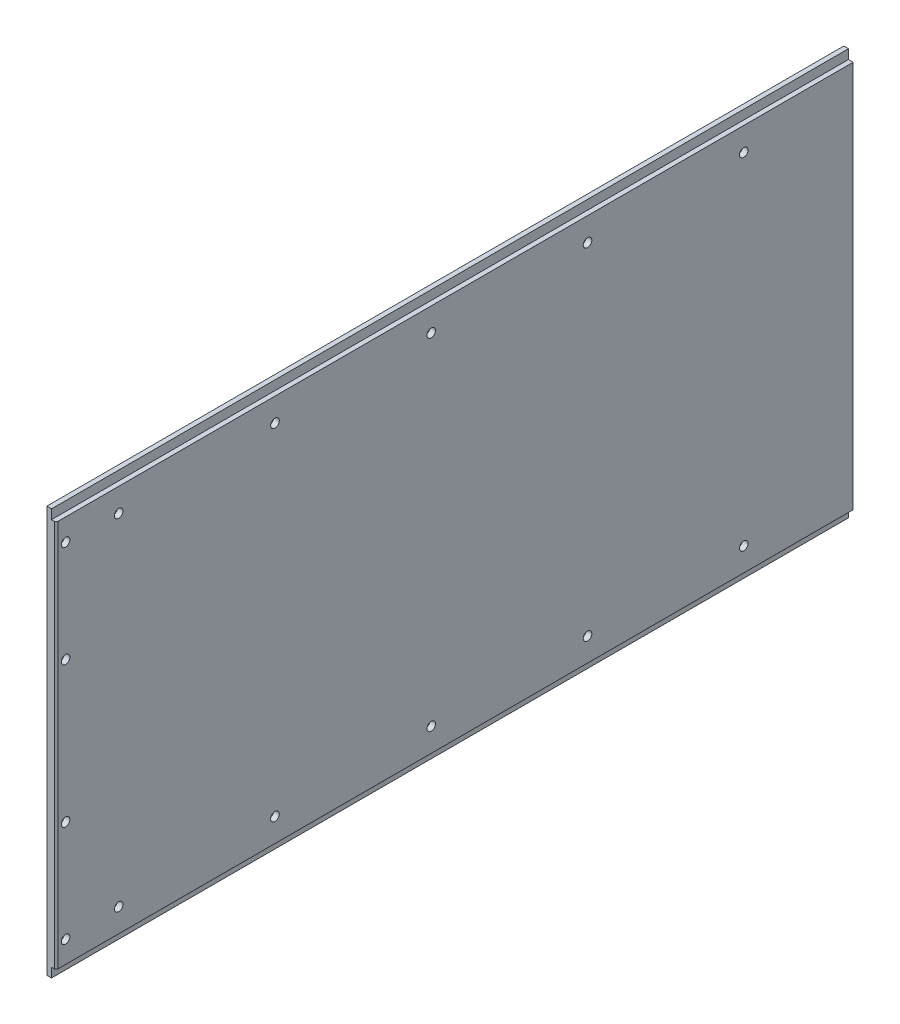
from build123d import *

# Parameters (mm, degrees)
SKETCH1_W                                            = 510
SKETCH1_H                                            = 260
BOSS_EXTRUDE1_DEPTH                                  = 6
SKIZZE2_W                                            = 3
SKIZZE2_H                                            = 6
SCHNITT_LINEAR_AUSTRAGEN1_DEPTH                      = 527.34209408
FORMSENKUNG_FUR_M5_LINSENSENKSCHRAUBE_MI_D           = 5.5
FORMSENKUNG_FUR_M5_LINSENSENKSCHRAUBE_MI_CSINK_D     = 10.4
FORMSENKUNG_FUR_M5_LINSENSENKSCHRAUBE_MI_CSINK_ANGLE = 90
CHAMFER1_SIZE                                        = 1
CSK_FOR_M5_COUNTERSUNK_RAISED_HEAD_SCREW_D           = 5.5
CSK_FOR_M5_COUNTERSUNK_RAISED_HEAD_SCREW_CSINK_D     = 10.4
CSK_FOR_M5_COUNTERSUNK_RAISED_HEAD_SCREW_CSINK_ANGLE = 90
LPATTERN1_COUNT                                      = 5
LPATTERN1_PITCH                                      = 100
SPIEGELN1_COPY_1_D                                   = 5.5
SPIEGELN1_COPY_1_CSINK_D                             = 10.4
SPIEGELN1_COPY_1_CSINK_ANGLE                         = 90
SPIEGELN1_COPY_2_D                                   = 5.5
SPIEGELN1_COPY_2_CSINK_D                             = 10.4
SPIEGELN1_COPY_2_CSINK_ANGLE                         = 90
SPIEGELN1_COPY_3_D                                   = 5.5
SPIEGELN1_COPY_3_CSINK_D                             = 10.4
SPIEGELN1_COPY_3_CSINK_ANGLE                         = 90
SPIEGELN1_COPY_4_D                                   = 5.5
SPIEGELN1_COPY_4_CSINK_D                             = 10.4
SPIEGELN1_COPY_4_CSINK_ANGLE                         = 90


with BuildPart() as part:
    # Sketch1 → Boss-Extrude1 (new body)
    with BuildSketch(Plane(origin=(0, 0, 0), x_dir=(0, 0, -1), z_dir=(1, 0, 0))):
        Rectangle(SKETCH1_W, SKETCH1_H)
    extrude(amount=BOSS_EXTRUDE1_DEPTH)

    # Skizze2 → Schnitt-Linear austragen1 (cut, through all)
    with BuildSketch(Plane.XY.offset(255)):
        with Locations((4.5, 127)):
            Rectangle(SKIZZE2_W, SKIZZE2_H)
        with Locations((4.5, -127)):
            Rectangle(SKIZZE2_W, SKIZZE2_H)
    extrude(amount=-SCHNITT_LINEAR_AUSTRAGEN1_DEPTH, mode=Mode.SUBTRACT)

    # Formsenkung fur M5 Linsensenkschraube mit Schlitz1 (through all)
    with Locations(Plane.ZY):
        with Locations((249, -110), (249, -45)):
            formsenkung_fur_m5_linsensenkschraube_mi = CounterSinkHole(FORMSENKUNG_FUR_M5_LINSENSENKSCHRAUBE_MI_D / 2, FORMSENKUNG_FUR_M5_LINSENSENKSCHRAUBE_MI_CSINK_D / 2, counter_sink_angle=FORMSENKUNG_FUR_M5_LINSENSENKSCHRAUBE_MI_CSINK_ANGLE)

    # Chamfer1
    chamfer1_edges = [part.edges().sort_by_distance(p)[0] for p in [
        (6, 0, 255),
    ]]
    chamfer(chamfer1_edges, length=CHAMFER1_SIZE)

    # CSK for M5 Countersunk Raised Head Screw1 (through all)
    with Locations(Plane.ZY):
        with Locations((215, -109)):
            csk_for_m5_countersunk_raised_head_screw = CounterSinkHole(CSK_FOR_M5_COUNTERSUNK_RAISED_HEAD_SCREW_D / 2, CSK_FOR_M5_COUNTERSUNK_RAISED_HEAD_SCREW_CSINK_D / 2, counter_sink_angle=CSK_FOR_M5_COUNTERSUNK_RAISED_HEAD_SCREW_CSINK_ANGLE)

    # LPattern1: CSK for M5 Countersunk Raised Head Screw1 ×5
    with Locations(*[(0, 0, -i * LPATTERN1_PITCH) for i in range(1, LPATTERN1_COUNT)]):
        add(csk_for_m5_countersunk_raised_head_screw, mode=Mode.SUBTRACT)

    # Spiegeln1: Formsenkung fur M5 Linsensenkschraube mit Schlitz1, CSK for M5 Countersunk Raised Head Screw1 across plane
    add(formsenkung_fur_m5_linsensenkschraube_mi.mirror(Plane.ZX), mode=Mode.SUBTRACT)
    add(csk_for_m5_countersunk_raised_head_screw.mirror(Plane.ZX), mode=Mode.SUBTRACT)

    # Spiegeln1 copy 1 (through all)
    with Locations(Plane(origin=(0, 0, -100), x_dir=(0, 0, 1), z_dir=(-1, 0, 0))):
        with Locations((215, 109)):
            CounterSinkHole(SPIEGELN1_COPY_1_D / 2, SPIEGELN1_COPY_1_CSINK_D / 2, counter_sink_angle=SPIEGELN1_COPY_1_CSINK_ANGLE)

    # Spiegeln1 copy 2 (through all)
    with Locations(Plane(origin=(0, 0, -200), x_dir=(0, 0, 1), z_dir=(-1, 0, 0))):
        with Locations((215, 109)):
            CounterSinkHole(SPIEGELN1_COPY_2_D / 2, SPIEGELN1_COPY_2_CSINK_D / 2, counter_sink_angle=SPIEGELN1_COPY_2_CSINK_ANGLE)

    # Spiegeln1 copy 3 (through all)
    with Locations(Plane(origin=(0, 0, -300), x_dir=(0, 0, 1), z_dir=(-1, 0, 0))):
        with Locations((215, 109)):
            CounterSinkHole(SPIEGELN1_COPY_3_D / 2, SPIEGELN1_COPY_3_CSINK_D / 2, counter_sink_angle=SPIEGELN1_COPY_3_CSINK_ANGLE)

    # Spiegeln1 copy 4 (through all)
    with Locations(Plane(origin=(0, 0, -400), x_dir=(0, 0, 1), z_dir=(-1, 0, 0))):
        with Locations((215, 109)):
            CounterSinkHole(SPIEGELN1_COPY_4_D / 2, SPIEGELN1_COPY_4_CSINK_D / 2, counter_sink_angle=SPIEGELN1_COPY_4_CSINK_ANGLE)


solid = part.part
